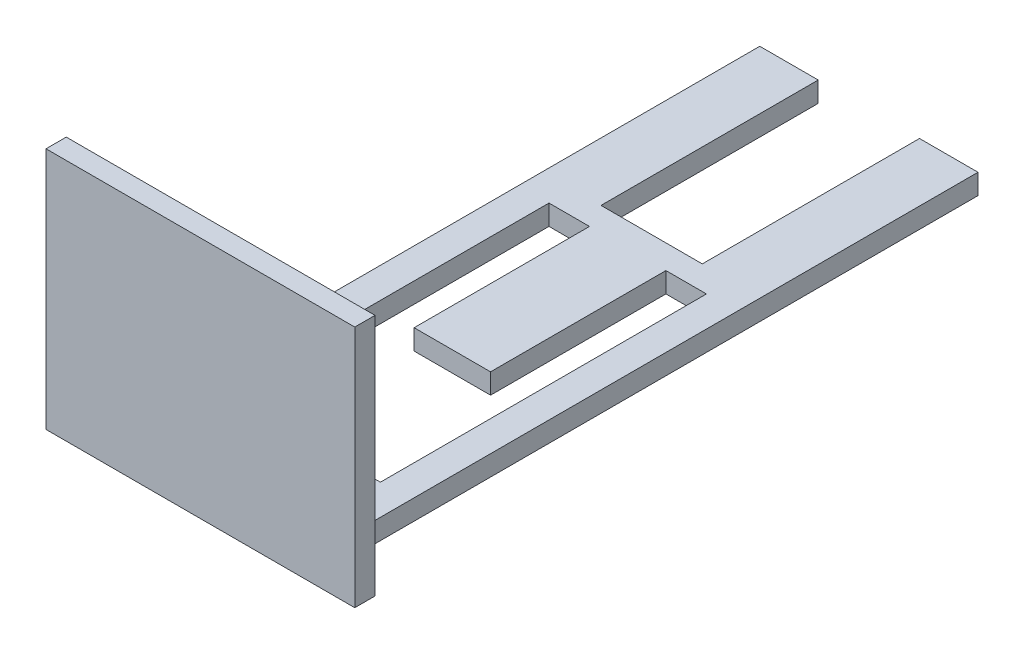
from build123d import *

# Parameters (mm, degrees)
BOSS_EXTRUDE1_DEPTH = 5.772427301
SKETCH2_W           = 10.772427301
SKETCH2_H           = 33
BOSS_EXTRUDE2_DEPTH = 1
CUT_EXTRUDE1_DEPTH  = 2
SKETCH16_W          = 10.772427301
SKETCH16_H          = 1
BOSS_EXTRUDE4_DEPTH = 11
CUT_EXTRUDE2_REACH  = 24.797
SKETCH26_W          = 5
SKETCH26_H          = 10.722198916
CUT_EXTRUDE3_DEPTH  = 24.875254024
SKETCH13_W          = 3.772427301
SKETCH13_H          = 2.348567359
CUT_EXTRUDE4_DEPTH  = 1
SKETCH27_W          = 1
SKETCH27_H          = 12
BOSS_EXTRUDE5_DEPTH = 2.235
SKETCH28_W          = 1
SKETCH28_H          = 12
BOSS_EXTRUDE6_DEPTH = 2.235


with BuildPart() as part:
    # Sketch1 → Boss-Extrude1 (new body)
    with BuildSketch(Plane(origin=(6.659481674, 0, 0), x_dir=(0, 0, -1), z_dir=(1, 0, 0))):
        Polygon((-2.250948222, -1), (-2.966896165, -1), (-2.966896165, -2.348567359), align=None)
    extrude(amount=-BOSS_EXTRUDE1_DEPTH)

    # Sketch2 → Boss-Extrude2 (add)
    with BuildSketch(Plane(origin=(0, -1, 0), x_dir=(-1, 0, 0), z_dir=(0, 1, 0))):
        with Locations((-4.773268024, -2.096039546)):
            Rectangle(SKETCH2_W, SKETCH2_H)
        Polygon((-0.887054373, 2.966896165), (-0.887054373, 9.403960454), (-8.659481674, 9.403960454), (-8.659481674, -6.69042347), (-6.659481674, -6.69042347), (-6.659481674, 2.966896165), align=None, mode=Mode.SUBTRACT)
    extrude(amount=BOSS_EXTRUDE2_DEPTH)

    # Sketch7 → Cut-Extrude1 (cut)
    with BuildSketch(Plane.ZY.offset(-0.887054373)):
        Polygon((2.250948222, -1), (2.966896165, -2.348567359), (2.966896165, 0), (-6.69042347, 0), (-6.69042347, -1), align=None)
    extrude(amount=-CUT_EXTRUDE1_DEPTH, mode=Mode.SUBTRACT)

    # Sketch16 → Boss-Extrude4 (add)
    with BuildSketch(Plane(origin=(0, 0, 0), x_dir=(1, 0, 0), z_dir=(0, 1, 0))):
        with Locations((4.773268024, -13.903960454)):
            Rectangle(SKETCH16_W, SKETCH16_H)
    extrude(amount=BOSS_EXTRUDE4_DEPTH)

    # Sketch23 → Cut-Extrude2 (cut, up to next)
    with BuildSketch(Plane.ZY.offset(-2.887054373), mode=Mode.PRIVATE) as cut_extrude2_sk1:
        Polygon((2.250948222, 0), (2.250948222, -0.125928185), (3.122325521, -1.835650648), (3.712956794, -1.835650648), (3.712956794, 0), align=None)
    cut_extrude2_tool1 = extrude(cut_extrude2_sk1.sketch, amount=-CUT_EXTRUDE2_REACH, mode=Mode.PRIVATE) & part.part
    add(cut_extrude2_tool1.solids().sort_by_distance((2.887054, -0.784154, 3.151212))[0], mode=Mode.SUBTRACT)

    # Sketch26 → Cut-Extrude3 (cut, through all)
    with BuildSketch(Plane(origin=(0, 0, 0), x_dir=(1, 0, 0), z_dir=(0, 1, 0))):
        with Locations((4.772054373, 13.234940088)):
            Rectangle(SKETCH26_W, SKETCH26_H)
    extrude(amount=-CUT_EXTRUDE3_DEPTH, mode=Mode.SUBTRACT)

    # Sketch13 → Cut-Extrude4 (cut)
    with BuildSketch(Plane.XY.offset(2.966896165)):
        with Locations((4.773268024, -1.17428368)):
            Rectangle(SKETCH13_W, SKETCH13_H)
    extrude(amount=-CUT_EXTRUDE4_DEPTH, mode=Mode.SUBTRACT)

    # Sketch27 → Boss-Extrude5 (add)
    with BuildSketch(Plane.ZY.offset(0.612945627)):
        with Locations((13.903960454, 5)):
            Rectangle(SKETCH27_W, SKETCH27_H)
    extrude(amount=BOSS_EXTRUDE5_DEPTH)

    # Sketch28 → Boss-Extrude6 (add)
    with BuildSketch(Plane(origin=(10.159481674, 0, 0), x_dir=(0, 0, -1), z_dir=(1, 0, 0))):
        with Locations((-13.903960454, 5)):
            Rectangle(SKETCH28_W, SKETCH28_H)
    extrude(amount=BOSS_EXTRUDE6_DEPTH)


solid = part.part
